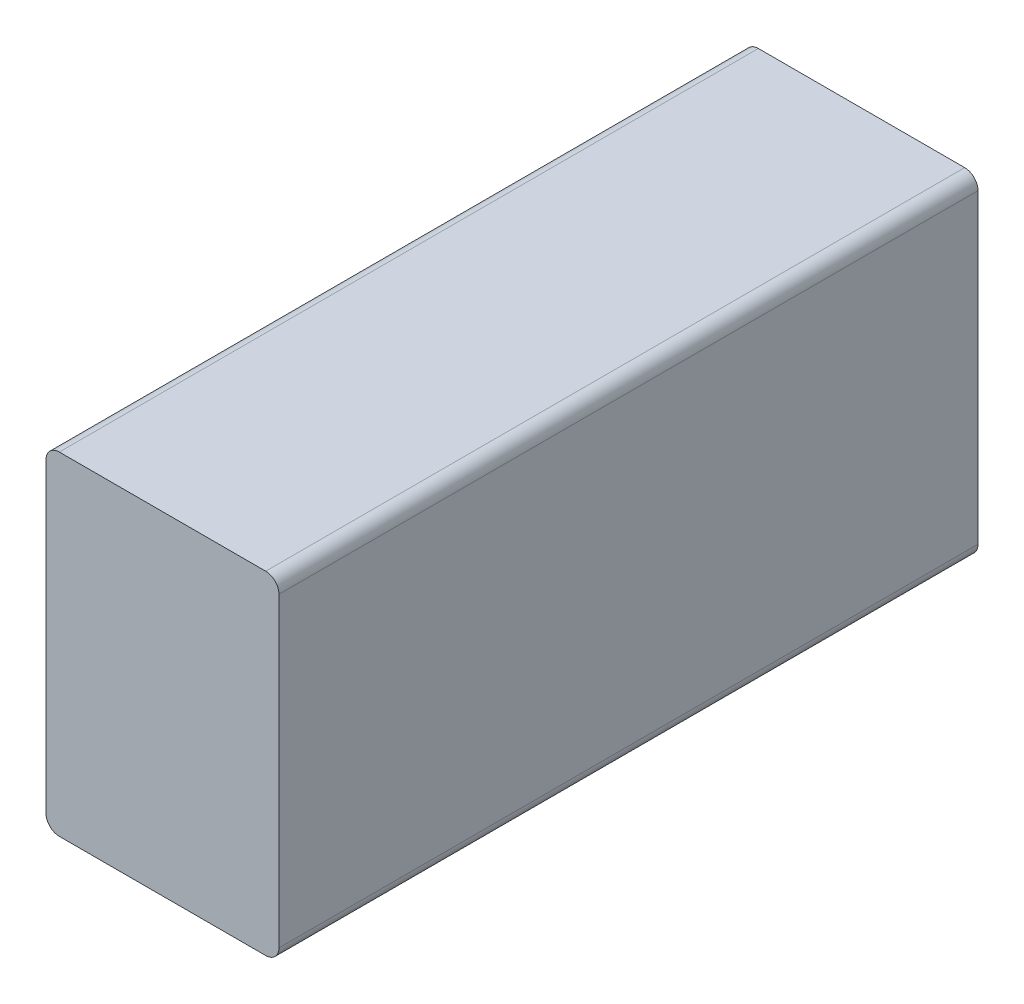
from build123d import *

# Parameters (mm, degrees)
SKETCH1_W           = 35
SKETCH1_H           = 50
BOSS_EXTRUDE1_DEPTH = 105
FILLET1_R           = 2


with BuildPart() as part:
    # Sketch1 → Boss-Extrude1 (new body)
    with BuildSketch(Plane.XY):
        Rectangle(SKETCH1_W, SKETCH1_H)
    extrude(amount=BOSS_EXTRUDE1_DEPTH)

    # Fillet1
    fillet1_edges = [part.edges().sort_by_distance(p)[0] for p in [
        (17.5, -25, 52.5),
        (-17.5, -25, 52.5),
        (-17.5, 25, 52.5),
        (17.5, 25, 52.5),
    ]]
    fillet(fillet1_edges, radius=FILLET1_R)


solid = part.part
